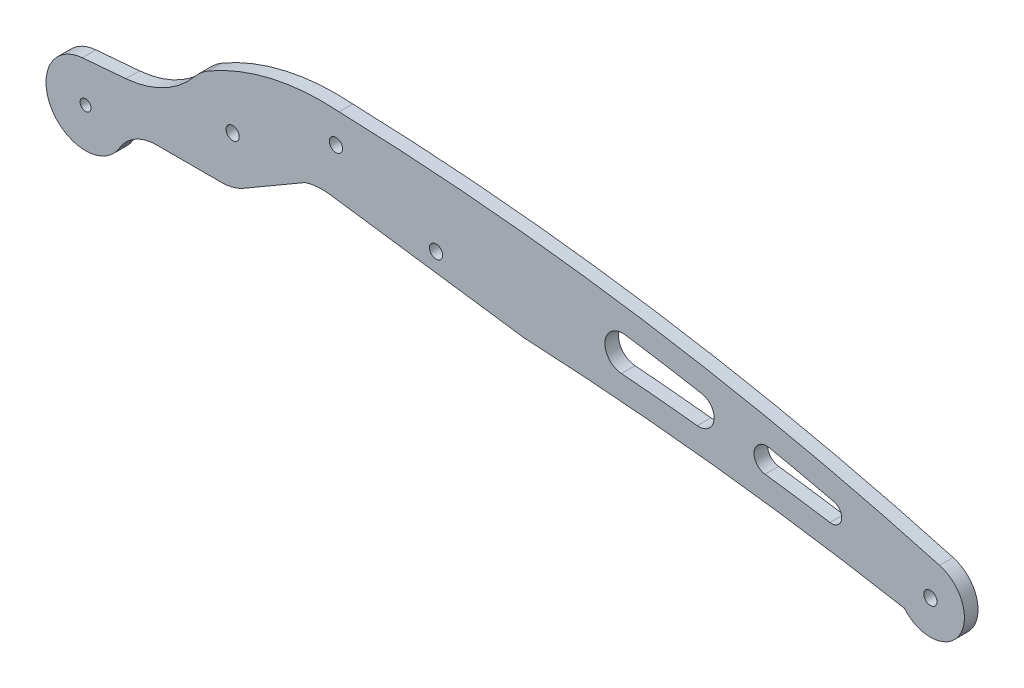
from build123d import *

# Parameters (mm, degrees)
SKETCH1_R           = 2.5
SKETCH1_R_2         = 3
BOSS_EXTRUDE1_DEPTH = 6.2


with BuildPart() as part:
    # Sketch1 → Boss-Extrude1 (new body)
    with BuildSketch(Plane.XY):
        with BuildLine():
            Line((85.6, -33.2), (-2.718519223, -20.878508118))
            ThreePointArc((-2.718519223, -20.878508118), (-8.41017463, -20.715920511), (-14, -21.8))
            Line((-14, -21.8), (-42.039824529, -38.092696265))
            ThreePointArc((-42.039824529, -38.092696265), (-46.884666341, -40.111316958), (-52.087842039, -40.8))
            Line((-52.087842039, -40.8), (-81.699109919, -40.8))
            ThreePointArc((-81.699109919, -40.8), (-91.370795398, -43.36753119), (-98.495572761, -50.394))
            ThreePointArc((-98.495572761, -50.394), (-129.24406218, -50.82175889), (-115.5, -23.312608885))
            Line((-115.5, -23.312608885), (-95.618089435, -21.65))
            ThreePointArc((-95.618089435, -21.65), (-78.309182519, -16.601252711), (-64.341378668, -5.2))
            ThreePointArc((-64.341378668, -5.2), (-61.413749232, -2.21456762), (-58, 0.2))
            ThreePointArc((-58, 0.2), (-29.282001226, 11.518177334), (1.5, 13.818827736))
            ThreePointArc((1.5, 13.818827736), (139.454874424, 0.958251967), (274.87829908, -28.323787594))
            ThreePointArc((274.87829908, -28.323787594), (283.738974288, -51.630641354), (258.857280718, -53.25))
            ThreePointArc((258.857280718, -53.25), (172.558903288, -40.371111866), (85.6, -33.2))
        make_face()
        with Locations(Location((-114, -41.25, 0), (0, 0, 180))):
            Circle(SKETCH1_R, mode=Mode.SUBTRACT)
        with Locations(Location((-47, -18.8, 0), (0, 0, 180))):
            Circle(SKETCH1_R_2, mode=Mode.SUBTRACT)
        with Locations(Location((45.6, -19.2, 0), (0, 0, 180))):
            Circle(SKETCH1_R_2, mode=Mode.SUBTRACT)
        with Locations(Location((0, 0, 0), (0, 0, 180))):
            Circle(SKETCH1_R_2, mode=Mode.SUBTRACT)
        with Locations(Location((270.7, -43.25, 0), (0, 0, 180))):
            Circle(SKETCH1_R_2, mode=Mode.SUBTRACT)
        with BuildLine():
            ThreePointArc((226.744224082, -27.259797753), (211.929816899, -23.860779344), (197.071572094, -20.658819377))
            ThreePointArc((197.071572094, -20.658819377), (190.434794526, -25.546132018), (195.40651845, -32.119913468))
            ThreePointArc((195.40651845, -32.119913468), (210.197393834, -34.160215491), (224.964543777, -36.365688118))
            ThreePointArc((224.964543777, -36.365688118), (230.232403999, -32.668395241), (226.744224082, -27.259797753))
        make_face(mode=Mode.SUBTRACT)
        with BuildLine():
            ThreePointArc((132.347185699, -9.089339403), (122.571709195, -15.840894216), (130.010518711, -25.104130489))
            ThreePointArc((130.010518711, -25.104130489), (147.296090717, -26.642266435), (164.560225388, -28.404797523))
            ThreePointArc((164.560225388, -28.404797523), (172.152990765, -22.51669502), (166.534944909, -14.721991823))
            ThreePointArc((166.534944909, -14.721991823), (149.462384392, -11.776267989), (132.347185699, -9.089339403))
        make_face(mode=Mode.SUBTRACT)
    extrude(amount=BOSS_EXTRUDE1_DEPTH)


solid = part.part
